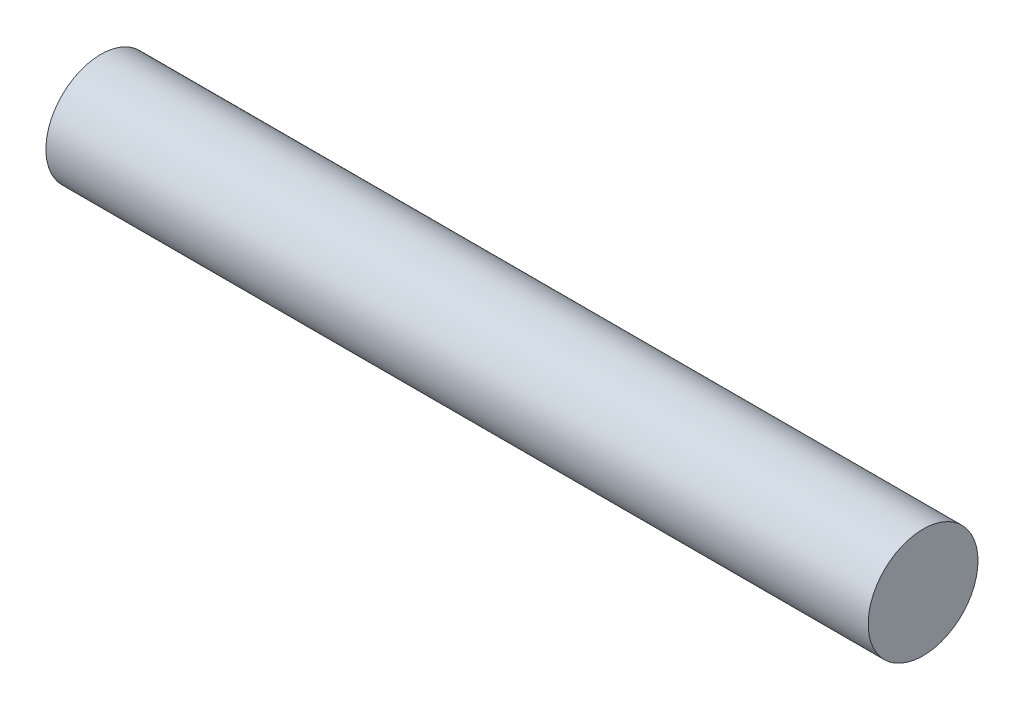
from build123d import *

# Parameters (mm, degrees)
SWEEP1_PROFILE_R = 20


with BuildPart() as part:
    # Sweep1: sweep along a path in Sketch1
    with BuildLine(Plane.XY) as sweep1_path:
        Line((0, 0), (299.496862109, 0))
    # Sweep1 profile (on start of the path) → Sweep1 (sweep)
    with BuildSketch(Plane(origin=(0, 0, 0), x_dir=(0, 0, 1), z_dir=(1, 0, 0))):
        Circle(SWEEP1_PROFILE_R)
    sweep(path=sweep1_path.line)


solid = part.part
